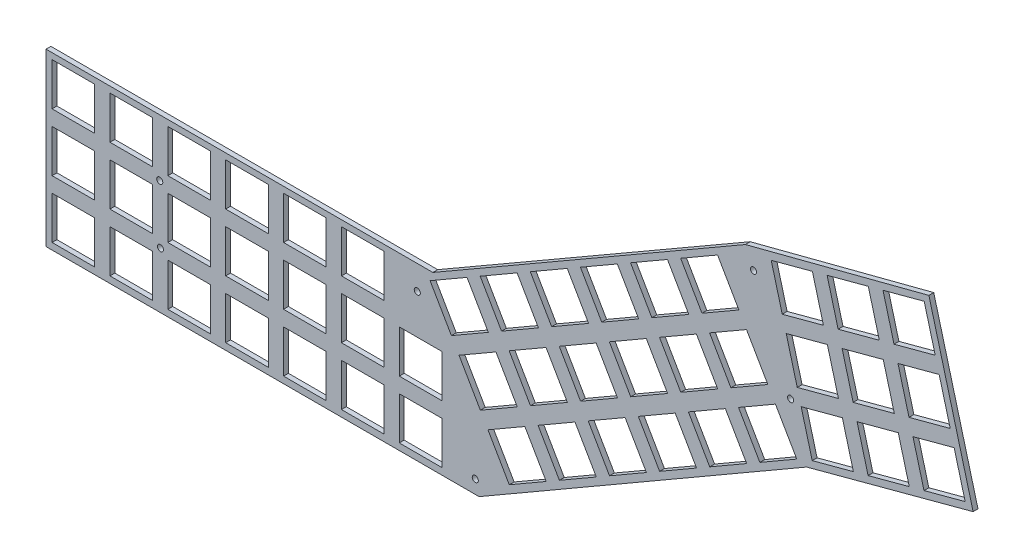
from build123d import *

# Parameters (mm, degrees)
ESQUISSE2_W        = 14
ESQUISSE2_H        = 14
ESQUISSE2_R        = 1
BOSS_EXTRU_1_DEPTH = 1.6


with BuildPart() as part:
    # Esquisse2 → Boss.-Extru.1 (new body)
    with BuildSketch(Plane.XY):
        Polygon((98.150595456, 11.331634302), (152.811395456, 25.971686302), (138.282595456, 80.221514302), (78.010935456, 64.541586302), (-24.588554544, 5.301674302), (-151.608757489, 5.292943326), (-151.608757489, -50.858487698), (-9.398592544, -50.858487698), align=None)
        with Locations((-142.608757489, -41.687645053)):
            Rectangle(ESQUISSE2_W, ESQUISSE2_H, mode=Mode.SUBTRACT)
        with Locations((-123.608757489, -41.687645053)):
            Rectangle(ESQUISSE2_W, ESQUISSE2_H, mode=Mode.SUBTRACT)
        with Locations((-104.608757489, -41.687645053)):
            Rectangle(ESQUISSE2_W, ESQUISSE2_H, mode=Mode.SUBTRACT)
        with Locations((-85.608757489, -41.687645053)):
            Rectangle(ESQUISSE2_W, ESQUISSE2_H, mode=Mode.SUBTRACT)
        with Locations((-114.030844544, -32.493525698)):
            Circle(ESQUISSE2_R, mode=Mode.SUBTRACT)
        with Locations((-142.608757489, -22.687645053)):
            Rectangle(ESQUISSE2_W, ESQUISSE2_H, mode=Mode.SUBTRACT)
        with Locations((-123.608757489, -22.687645053)):
            Rectangle(ESQUISSE2_W, ESQUISSE2_H, mode=Mode.SUBTRACT)
        with Locations((-104.608757489, -22.687645053)):
            Rectangle(ESQUISSE2_W, ESQUISSE2_H, mode=Mode.SUBTRACT)
        with Locations((-85.608757489, -22.687645053)):
            Rectangle(ESQUISSE2_W, ESQUISSE2_H, mode=Mode.SUBTRACT)
        with Locations((-66.608757489, -41.687645053)):
            Rectangle(ESQUISSE2_W, ESQUISSE2_H, mode=Mode.SUBTRACT)
        with Locations((-47.608757489, -41.687645053)):
            Rectangle(ESQUISSE2_W, ESQUISSE2_H, mode=Mode.SUBTRACT)
        with Locations((-10.652844544, -46.438125698)):
            Circle(ESQUISSE2_R, mode=Mode.SUBTRACT)
        with Locations((-28.608757489, -41.687645053)):
            Rectangle(ESQUISSE2_W, ESQUISSE2_H, mode=Mode.SUBTRACT)
        with Locations((-66.608757489, -22.687645053)):
            Rectangle(ESQUISSE2_W, ESQUISSE2_H, mode=Mode.SUBTRACT)
        with Locations((-47.608757489, -22.687645053)):
            Rectangle(ESQUISSE2_W, ESQUISSE2_H, mode=Mode.SUBTRACT)
        with Locations((-28.608757489, -22.687645053)):
            Rectangle(ESQUISSE2_W, ESQUISSE2_H, mode=Mode.SUBTRACT)
        with Locations((-114.259444544, -13.418125698)):
            Circle(ESQUISSE2_R, mode=Mode.SUBTRACT)
        with Locations((-142.608757489, -3.687645053)):
            Rectangle(ESQUISSE2_W, ESQUISSE2_H, mode=Mode.SUBTRACT)
        with Locations((-123.608757489, -3.687645053)):
            Rectangle(ESQUISSE2_W, ESQUISSE2_H, mode=Mode.SUBTRACT)
        with Locations((-104.608757489, -3.687645053)):
            Rectangle(ESQUISSE2_W, ESQUISSE2_H, mode=Mode.SUBTRACT)
        with Locations((-85.608757489, -3.687645053)):
            Rectangle(ESQUISSE2_W, ESQUISSE2_H, mode=Mode.SUBTRACT)
        with Locations((-66.608757489, -3.687645053)):
            Rectangle(ESQUISSE2_W, ESQUISSE2_H, mode=Mode.SUBTRACT)
        with Locations((-47.608757489, -3.687645053)):
            Rectangle(ESQUISSE2_W, ESQUISSE2_H, mode=Mode.SUBTRACT)
        Polygon((-15.994741241, -13.947304814), (-3.870385588, -6.947304814), (3.129614412, -19.071660467), (-8.994741241, -26.071660467), align=None, mode=Mode.SUBTRACT)
        with Locations((-29.702844544, -2.648525698)):
            Circle(ESQUISSE2_R, mode=Mode.SUBTRACT)
        Polygon((-25.494741241, 2.507177858), (-13.370385588, 9.507177858), (-6.370385588, -2.617177795), (-18.494741241, -9.617177795), align=None, mode=Mode.SUBTRACT)
        Polygon((-9.040258569, 12.007177858), (3.084097084, 19.007177858), (10.084097084, 6.882822205), (-2.040258569, -0.117177795), align=None, mode=Mode.SUBTRACT)
        Polygon((-6.494741241, -30.401787486), (5.629614412, -23.401787486), (12.629614412, -35.526143139), (0.505258759, -42.526143139), align=None, mode=Mode.SUBTRACT)
        Polygon((9.959741431, -20.901787486), (22.084097084, -13.901787486), (29.084097084, -26.026143139), (16.959741431, -33.026143139), align=None, mode=Mode.SUBTRACT)
        Polygon((26.414224103, -11.401787486), (38.538579756, -4.401787486), (45.538579756, -16.526143139), (33.414224103, -23.526143139), align=None, mode=Mode.SUBTRACT)
        Polygon((0.459741431, -4.447304814), (12.584097084, 2.552695186), (19.584097084, -9.571660467), (7.459741431, -16.571660467), align=None, mode=Mode.SUBTRACT)
        Polygon((42.868706775, -1.901787486), (54.993062428, 5.098212514), (61.993062428, -7.026143139), (49.868706775, -14.026143139), align=None, mode=Mode.SUBTRACT)
        Polygon((16.914224103, 5.052695186), (29.038579756, 12.052695186), (36.038579756, -0.071660467), (23.914224103, -7.071660467), align=None, mode=Mode.SUBTRACT)
        Polygon((59.323189447, 7.598212514), (71.4475451, 14.598212514), (78.4475451, 2.473856861), (66.323189447, -4.526143139), align=None, mode=Mode.SUBTRACT)
        Polygon((33.368706775, 14.552695186), (45.493062428, 21.552695186), (52.493062428, 9.428339533), (40.368706775, 2.428339533), align=None, mode=Mode.SUBTRACT)
        Polygon((75.777672119, 17.098212514), (87.902027772, 24.098212514), (94.902027772, 11.973856861), (82.777672119, 4.973856861), align=None, mode=Mode.SUBTRACT)
        Polygon((7.414224103, 21.507177858), (19.538579756, 28.507177858), (26.538579756, 16.382822205), (14.414224103, 9.382822205), align=None, mode=Mode.SUBTRACT)
        Polygon((23.868706775, 31.007177858), (35.993062428, 38.007177858), (42.993062428, 25.882822205), (30.868706775, 18.882822205), align=None, mode=Mode.SUBTRACT)
        Polygon((49.823189447, 24.052695186), (61.9475451, 31.052695186), (68.9475451, 18.928339533), (56.823189447, 11.928339533), align=None, mode=Mode.SUBTRACT)
        Polygon((66.277672119, 33.552695186), (78.402027772, 40.552695186), (85.402027772, 28.428339533), (73.277672119, 21.428339533), align=None, mode=Mode.SUBTRACT)
        Polygon((40.323189447, 40.507177858), (52.4475451, 47.507177858), (59.4475451, 35.382822205), (47.323189447, 28.382822205), align=None, mode=Mode.SUBTRACT)
        Polygon((56.777672119, 50.007177858), (68.902027772, 57.007177858), (75.902027772, 44.882822205), (63.777672119, 37.882822205), align=None, mode=Mode.SUBTRACT)
        Polygon((99.972171674, 14.073979229), (96.348705043, 27.596940797), (109.871666611, 31.220407428), (113.495133242, 17.69744586), align=None, mode=Mode.SUBTRACT)
        with Locations((92.877555456, 28.085474302)):
            Circle(ESQUISSE2_R, mode=Mode.SUBTRACT)
        Polygon((118.324762374, 18.991541086), (114.701295742, 32.514502654), (128.22425731, 36.137969285), (131.847723942, 22.615007717), align=None, mode=Mode.SUBTRACT)
        Polygon((95.054609817, 32.426569928), (91.431143186, 45.949531496), (104.954104754, 49.572998128), (108.577571385, 36.05003656), align=None, mode=Mode.SUBTRACT)
        Polygon((136.677353073, 23.909102943), (133.053886442, 37.432064511), (146.57684801, 41.055531142), (150.200314641, 27.532569574), align=None, mode=Mode.SUBTRACT)
        Polygon((113.407200517, 37.344131785), (109.783733885, 50.867093353), (123.306695453, 54.490559985), (126.930162085, 40.967598417), align=None, mode=Mode.SUBTRACT)
        with Locations((80.685555456, 58.489274302)):
            Circle(ESQUISSE2_R, mode=Mode.SUBTRACT)
        Polygon((90.13704796, 50.779160628), (86.513581329, 64.302122196), (100.036542897, 67.925588827), (103.660009528, 54.402627259), align=None, mode=Mode.SUBTRACT)
        Polygon((131.759791216, 42.261693642), (128.136324585, 55.78465521), (141.659286153, 59.408121842), (145.282752784, 45.885160273), align=None, mode=Mode.SUBTRACT)
        Polygon((108.48963866, 55.696722485), (104.866172028, 69.219684053), (118.389133596, 72.843150684), (122.012600228, 59.320189116), align=None, mode=Mode.SUBTRACT)
        Polygon((126.842229359, 60.614284342), (123.218762728, 74.13724591), (136.741724296, 77.760712541), (140.365190927, 64.237750973), align=None, mode=Mode.SUBTRACT)
    extrude(amount=BOSS_EXTRU_1_DEPTH)


solid = part.part
